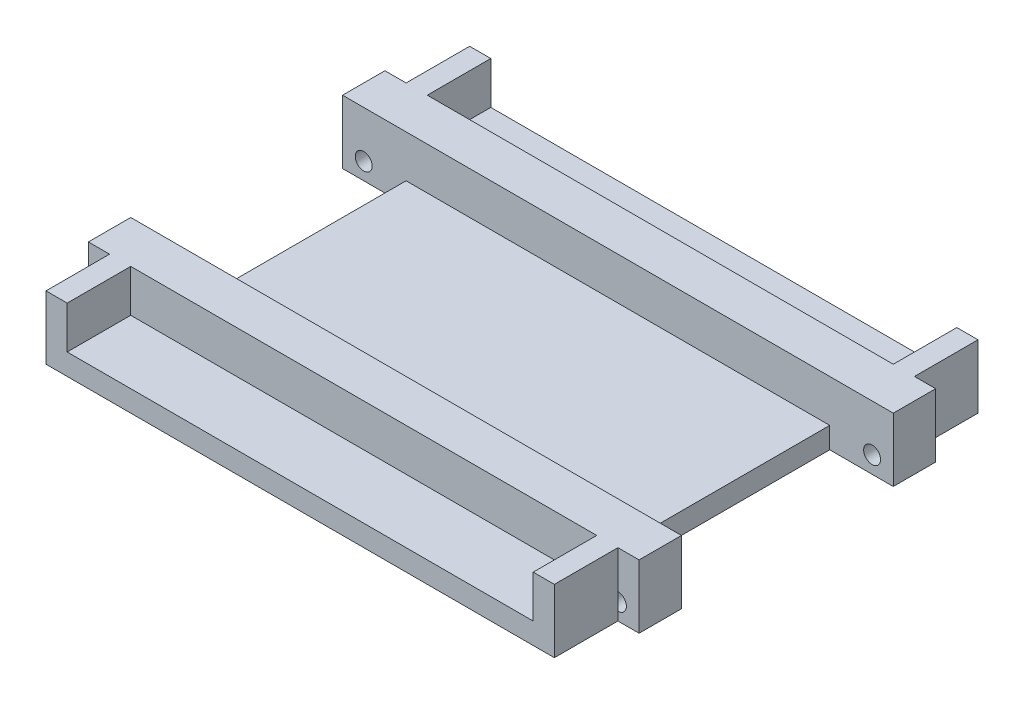
from build123d import *

# Parameters (mm, degrees)
SKETCH1_W           = 100
SKETCH1_H           = 50
BOSS_EXTRUDE1_DEPTH = 5
SKETCH2_W           = 130
SKETCH2_H           = 15
BOSS_EXTRUDE2_DEPTH = 10
SKETCH3_W           = 130
SKETCH3_H           = 15
BOSS_EXTRUDE3_DEPTH = 10
SKETCH4_R           = 2
CUT_EXTRUDE1_DEPTH  = 97.695398029
SKETCH5_R           = 2
CUT_EXTRUDE2_DEPTH  = 97.695398029
SKETCH7_W           = 120
SKETCH7_H           = 5
BOSS_EXTRUDE4_DEPTH = 15
SKETCH8_W           = 5
SKETCH8_H           = 15
BOSS_EXTRUDE5_DEPTH = 10
SKETCH11_W          = 120
SKETCH11_H          = 5
BOSS_EXTRUDE6_DEPTH = 15
SKETCH12_W          = 5
SKETCH12_H          = 15
BOSS_EXTRUDE7_DEPTH = 10


with BuildPart() as part:
    # Sketch1 → Boss-Extrude1 (new body)
    with BuildSketch(Plane(origin=(0, 0, 0), x_dir=(1, 0, 0), z_dir=(0, 1, 0))):
        Rectangle(SKETCH1_W, SKETCH1_H)
    extrude(amount=BOSS_EXTRUDE1_DEPTH)

    # Sketch2 → Boss-Extrude2 (add)
    with BuildSketch(Plane.XY.offset(25)):
        with Locations((0, 7.5)):
            Rectangle(SKETCH2_W, SKETCH2_H)
    extrude(amount=BOSS_EXTRUDE2_DEPTH)

    # Sketch3 → Boss-Extrude3 (add)
    with BuildSketch(Plane(origin=(0, 0, -25), x_dir=(-1, 0, 0), z_dir=(0, 0, -1))):
        with Locations((0, 7.5)):
            Rectangle(SKETCH3_W, SKETCH3_H)
    extrude(amount=BOSS_EXTRUDE3_DEPTH)

    # Sketch4 → Cut-Extrude1 (cut, through all)
    with BuildSketch(Plane.XY.offset(35)):
        with Locations((-60, 4)):
            Circle(SKETCH4_R)
    extrude(amount=-CUT_EXTRUDE1_DEPTH, mode=Mode.SUBTRACT)

    # Sketch5 → Cut-Extrude2 (cut, through all)
    with BuildSketch(Plane.XY.offset(35)):
        with Locations((60, 4)):
            Circle(SKETCH5_R)
    extrude(amount=-CUT_EXTRUDE2_DEPTH, mode=Mode.SUBTRACT)

    # Sketch7 → Boss-Extrude4 (add)
    with BuildSketch(Plane.XY.offset(35)):
        with Locations((0, 2.5)):
            Rectangle(SKETCH7_W, SKETCH7_H)
    extrude(amount=BOSS_EXTRUDE4_DEPTH)

    # Sketch8 → Boss-Extrude5 (add)
    with BuildSketch(Plane(origin=(0, 5, 0), x_dir=(1, 0, 0), z_dir=(0, 1, 0))):
        with Locations((-57.5, -42.5)):
            Rectangle(SKETCH8_W, SKETCH8_H)
        with Locations((57.5, -42.5)):
            Rectangle(SKETCH8_W, SKETCH8_H)
    extrude(amount=BOSS_EXTRUDE5_DEPTH)

    # Sketch11 → Boss-Extrude6 (add)
    with BuildSketch(Plane(origin=(0, 0, -35), x_dir=(-1, 0, 0), z_dir=(0, 0, -1))):
        with Locations((0, 2.5)):
            Rectangle(SKETCH11_W, SKETCH11_H)
    extrude(amount=BOSS_EXTRUDE6_DEPTH)

    # Sketch12 → Boss-Extrude7 (add)
    with BuildSketch(Plane(origin=(0, 5, 0), x_dir=(1, 0, 0), z_dir=(0, 1, 0))):
        with Locations((-57.5, 42.5)):
            Rectangle(SKETCH12_W, SKETCH12_H)
        with Locations((57.5, 42.5)):
            Rectangle(SKETCH12_W, SKETCH12_H)
    extrude(amount=BOSS_EXTRUDE7_DEPTH)


solid = part.part
